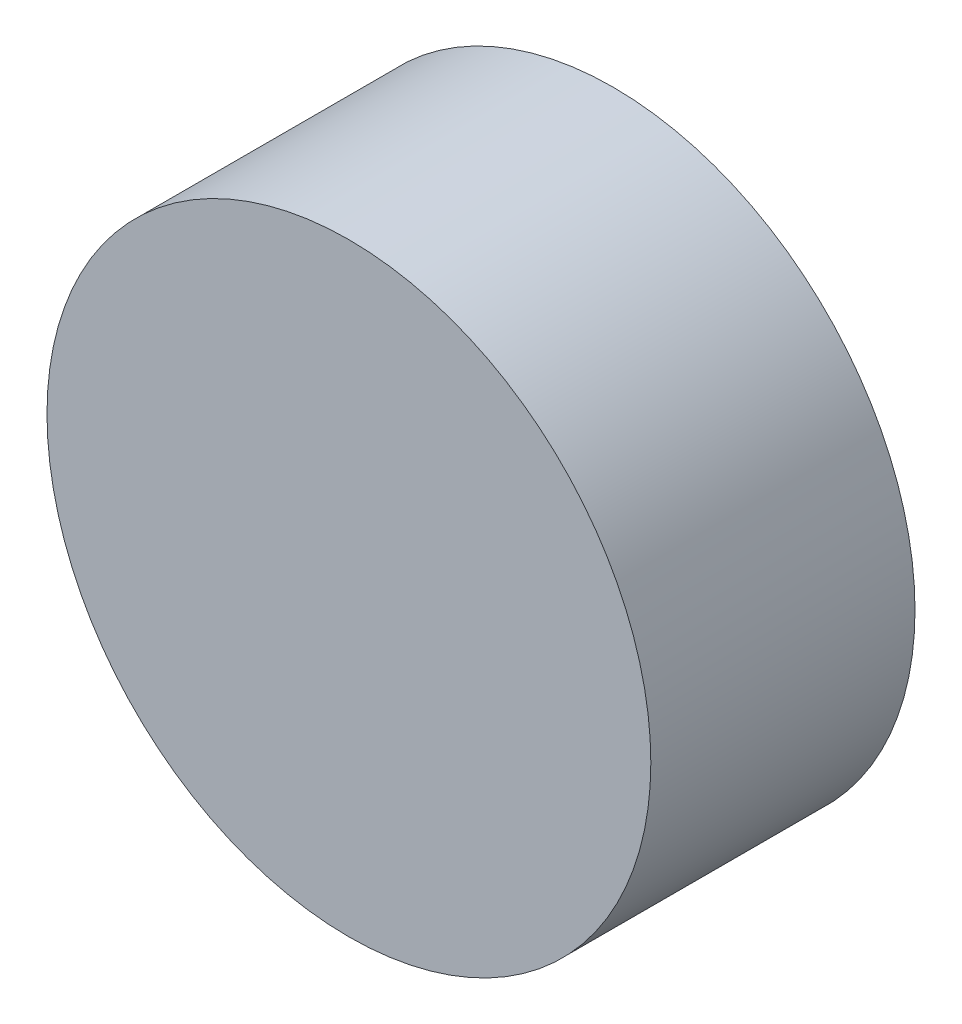
from build123d import *

# Parameters (mm, degrees)
EXTRUDE_SKETCH_1_R = 16
EXTRUDE_1_DEPTH    = 14


with BuildPart() as part:
    # Extrude sketch 1 → Extrude 1 (new body)
    with BuildSketch(Plane.XY):
        Circle(EXTRUDE_SKETCH_1_R)
    extrude(amount=EXTRUDE_1_DEPTH)


solid = part.part
